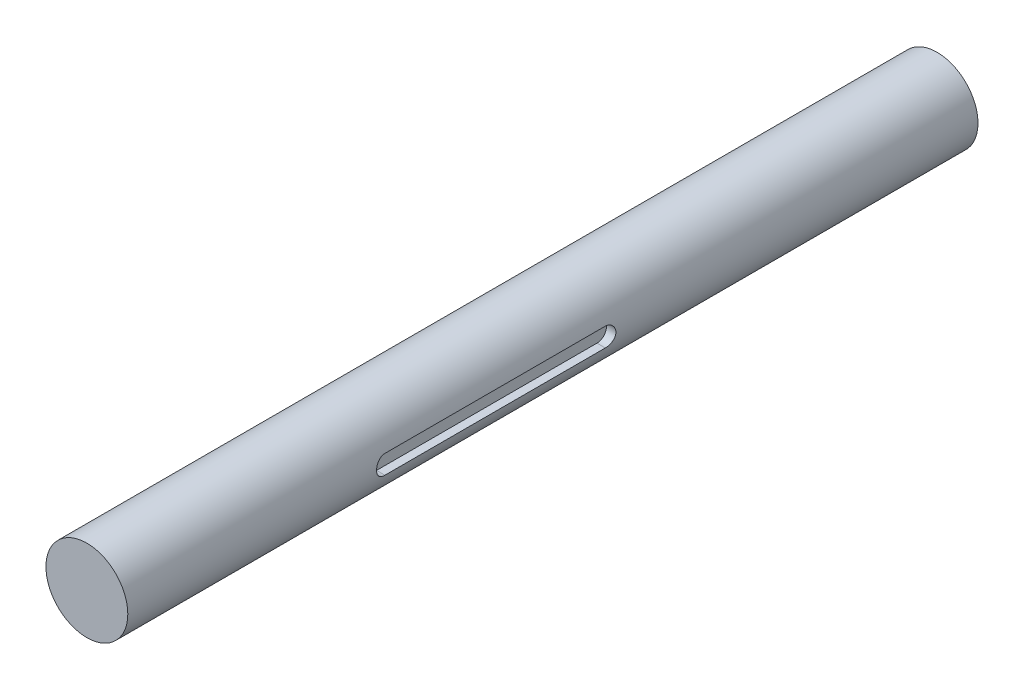
from build123d import *

# Parameters (mm, degrees)
SKETCH1_R           = 6.5
BOSS_EXTRUDE1_DEPTH = 67.5
CUT_EXTRUDE1_START  = 6.5
CUT_EXTRUDE1_DEPTH  = 1.5


with BuildPart() as part:
    # Sketch1 → Boss-Extrude1 (new, symmetric)
    with BuildSketch(Plane.XY):
        Circle(SKETCH1_R)
    extrude(amount=BOSS_EXTRUDE1_DEPTH, both=True)

    # Sketch2 → Cut-Extrude1 (cut)
    with BuildSketch(Plane(origin=(0, 0, 0), x_dir=(0, 0, -1), z_dir=(1, 0, 0)).offset(CUT_EXTRUDE1_START)):
        with BuildLine():
            Line((-26.5, 1.5), (8.5, 1.5))
            ThreePointArc((8.5, 1.5), (10, 0), (8.5, -1.5))
            Line((8.5, -1.5), (-26.5, -1.5))
            ThreePointArc((-26.5, -1.5), (-28, 0), (-26.5, 1.5))
        make_face()
    extrude(amount=-CUT_EXTRUDE1_DEPTH, mode=Mode.SUBTRACT)


solid = part.part
